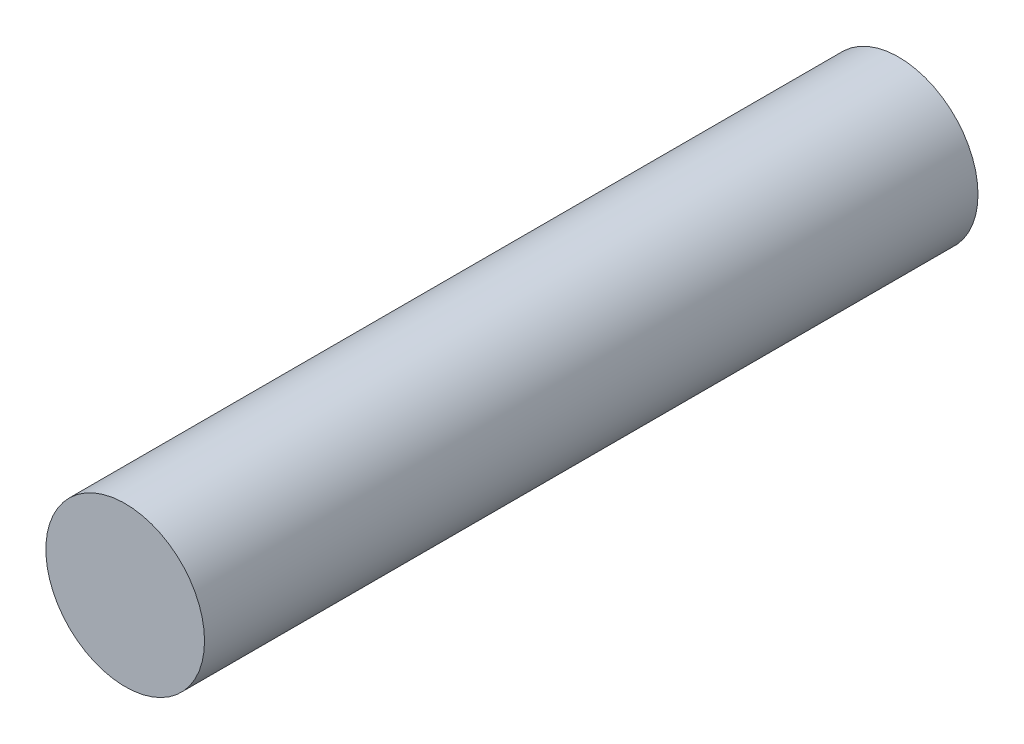
from build123d import *

# Parameters (mm, degrees)
SKETCH1_R           = 7.1807
BOSS_EXTRUDE1_DEPTH = 35


with BuildPart() as part:
    # Sketch1 → Boss-Extrude1 (new, symmetric)
    with BuildSketch(Plane.XY):
        Circle(SKETCH1_R)
    extrude(amount=BOSS_EXTRUDE1_DEPTH, both=True)


solid = part.part
